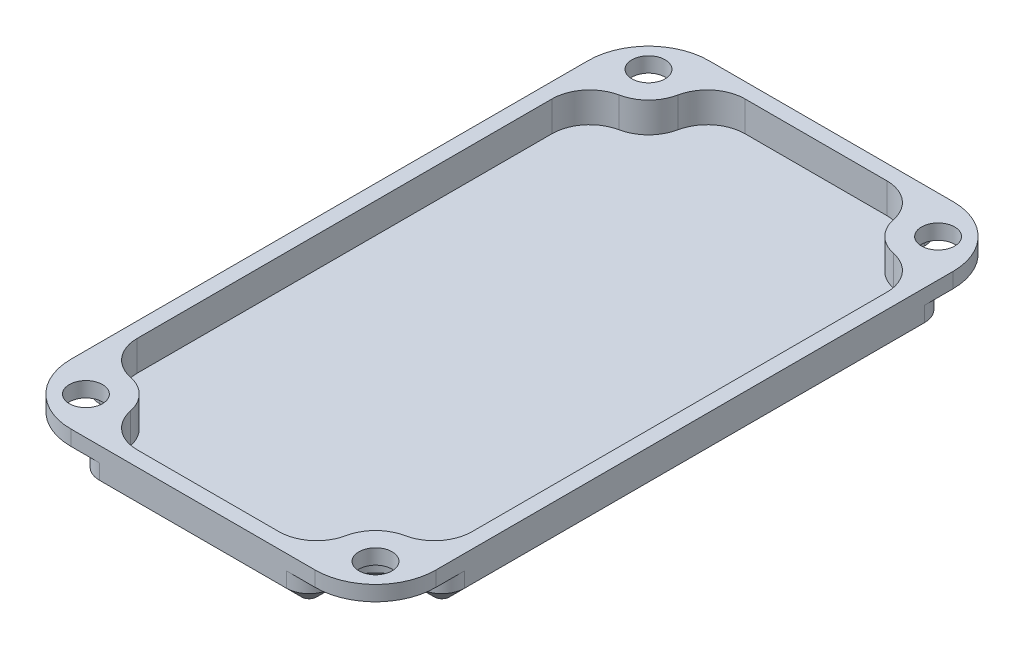
from build123d import *

# Parameters (mm, degrees)
SKETCH_1_W               = 24.2
SKETCH_1_H               = 42.3
EXTRUDE_1_DEPTH          = 3
FILLET_1_R               = 4
CUT_EXTRUDE_1_DEPTH      = 2
EXTRUDE_START            = 2
EXTRUDE_2_DEPTH          = 2
FILLET_2_R               = 2.5
CUT_EXTRUDE_2_DEPTH      = 25.550611138
CUT_EXTRUDE_2_DEPTH_BACK = 25.550611138
SKETCH_4_R               = 1.1
CUT_EXTRUDE_3_DEPTH      = 2
FILLET_3_R               = 1.5
CHAMFER_1_SIZE           = 1


with BuildPart() as part:
    # 草图1 → 凸台-拉伸1 (new body)
    with BuildSketch(Plane(origin=(0, 0, 0), x_dir=(1, 0, 0), z_dir=(0, 1, 0))):
        Rectangle(SKETCH_1_W, SKETCH_1_H)
    extrude(amount=EXTRUDE_1_DEPTH)

    # 圆角1
    fillet_1_edges = [part.edges().sort_by_distance(p)[0] for p in [
        (12.1, 1.5, 21.15),
        (-12.1, 1.5, 21.15),
        (-12.1, 1.5, -21.15),
        (12.1, 1.5, -21.15),
    ]]
    fillet(fillet_1_edges, radius=FILLET_1_R)

    # 草图2 → 切除-拉伸1 (cut)
    with BuildSketch(Plane(origin=(0, 3, 0), x_dir=(1, 0, 0), z_dir=(0, 1, 0))):
        with BuildLine():
            Line((8.1, 20.15), (-8.1, 20.15))
            ThreePointArc((-8.1, 20.15), (-10.221320344, 19.271320344), (-11.1, 17.15))
            Line((-11.1, 17.15), (-11.1, -17.15))
            ThreePointArc((-11.1, -17.15), (-10.221320344, -19.271320344), (-8.1, -20.15))
            Line((-8.1, -20.15), (8.1, -20.15))
            ThreePointArc((8.1, -20.15), (10.221320344, -19.271320344), (11.1, -17.15))
            Line((11.1, -17.15), (11.1, 17.15))
            ThreePointArc((11.1, 17.15), (10.221320344, 19.271320344), (8.1, 20.15))
        make_face()
    extrude(amount=-CUT_EXTRUDE_1_DEPTH, mode=Mode.SUBTRACT)

    # 草图3 → 凸台-拉伸2 (add)
    with BuildSketch(Plane(origin=(0, 1, 0), x_dir=(1, 0, 0), z_dir=(0, 1, 0)).offset(EXTRUDE_START)):
        with BuildLine():
            Line((-9.6, 16.15), (-11.1, 16.15))
            Line((-11.1, 16.15), (-11.1, 17.15))
            ThreePointArc((-11.1, 17.15), (-10.221320344, 19.271320344), (-8.1, 20.15))
            Line((-8.1, 20.15), (-7.1, 20.15))
            Line((-7.1, 20.15), (-7.1, 18.65))
            ThreePointArc((-7.1, 18.65), (-7.832233047, 16.882233047), (-9.6, 16.15))
        make_face()
        with BuildLine():
            Line((7.1, 18.65), (7.1, 20.15))
            Line((7.1, 20.15), (8.1, 20.15))
            ThreePointArc((8.1, 20.15), (10.221320344, 19.271320344), (11.1, 17.15))
            Line((11.1, 17.15), (11.1, 16.15))
            Line((11.1, 16.15), (9.6, 16.15))
            ThreePointArc((9.6, 16.15), (7.832233047, 16.882233047), (7.1, 18.65))
        make_face()
        with BuildLine():
            Line((-8.1, -20.15), (-7.1, -20.15))
            Line((-7.1, -20.15), (-7.1, -18.65))
            ThreePointArc((-7.1, -18.65), (-7.832233047, -16.882233047), (-9.6, -16.15))
            Line((-9.6, -16.15), (-11.1, -16.15))
            Line((-11.1, -16.15), (-11.1, -17.15))
            ThreePointArc((-11.1, -17.15), (-10.221320344, -19.271320344), (-8.1, -20.15))
        make_face()
        with BuildLine():
            Line((11.1, -17.15), (11.1, -16.15))
            Line((11.1, -16.15), (9.6, -16.15))
            ThreePointArc((9.6, -16.15), (7.832233047, -16.882233047), (7.1, -18.65))
            Line((7.1, -18.65), (7.1, -20.15))
            Line((7.1, -20.15), (8.1, -20.15))
            ThreePointArc((8.1, -20.15), (10.221320344, -19.271320344), (11.1, -17.15))
        make_face()
    extrude(amount=-EXTRUDE_2_DEPTH)

    # 圆角2
    fillet_2_edges = [part.edges().sort_by_distance(p)[0] for p in [
        (7.1, 2, 20.15),
        (11.1, 2, 16.15),
        (11.1, 2, -16.15),
        (7.1, 2, -20.15),
        (-7.1, 2, -20.15),
        (-11.1, 2, 16.15),
        (-7.1, 2, 20.15),
        (-11.1, 2, -16.15),
    ]]
    fillet(fillet_2_edges, radius=FILLET_2_R)

    # 草图4 → 切除-拉伸2 (cut, two sides: drawn at the far end of the back side and taken through both)
    with BuildSketch(Plane.XZ.offset(-CUT_EXTRUDE_2_DEPTH_BACK)):
        with Locations(Location((-9.6, 18.65, 0), (0, 0, 270))):
            Circle(SKETCH_4_R)
        with Locations(Location((9.6, 18.65, 0), (0, 0, 270))):
            Circle(SKETCH_4_R)
        with Locations(Location((9.6, -18.65, 0), (0, 0, 270))):
            Circle(SKETCH_4_R)
        with Locations(Location((-9.6, -18.65, 0), (0, 0, 270))):
            Circle(SKETCH_4_R)
    extrude(amount=CUT_EXTRUDE_2_DEPTH + CUT_EXTRUDE_2_DEPTH_BACK, mode=Mode.SUBTRACT)

    # 草图5 → 切除-拉伸3 (cut)
    with BuildSketch(Plane.XZ):
        with BuildLine():
            Line((-9.6, 16.75), (-12.1, 16.75))
            Line((-12.1, 16.75), (-12.1, 21.15))
            Line((-12.1, 21.15), (-7.7, 21.15))
            Line((-7.7, 21.15), (-7.7, 18.65))
            ThreePointArc((-7.7, 18.65), (-8.256497116, 17.306497116), (-9.6, 16.75))
        make_face()
        with BuildLine():
            Line((9.6, 16.75), (12.1, 16.75))
            Line((12.1, 16.75), (12.1, 21.15))
            Line((12.1, 21.15), (7.7, 21.15))
            Line((7.7, 21.15), (7.7, 18.65))
            ThreePointArc((7.7, 18.65), (8.256497116, 17.306497116), (9.6, 16.75))
        make_face()
        with BuildLine():
            Line((9.6, -16.75), (12.1, -16.75))
            Line((12.1, -16.75), (12.1, -21.15))
            Line((12.1, -21.15), (7.7, -21.15))
            Line((7.7, -21.15), (7.7, -18.65))
            ThreePointArc((7.7, -18.65), (8.256497116, -17.306497116), (9.6, -16.75))
        make_face()
        with BuildLine():
            Line((-9.6, -16.75), (-12.1, -16.75))
            Line((-12.1, -16.75), (-12.1, -21.15))
            Line((-12.1, -21.15), (-7.7, -21.15))
            Line((-7.7, -21.15), (-7.7, -18.65))
            ThreePointArc((-7.7, -18.65), (-8.256497116, -17.306497116), (-9.6, -16.75))
        make_face()
    extrude(amount=-CUT_EXTRUDE_3_DEPTH, mode=Mode.SUBTRACT)

    # 圆角3
    fillet_3_edges = [part.edges().sort_by_distance(p)[0] for p in [
        (-7.7, 1, -21.15),
        (-12.1, 1, -16.75),
        (12.1, 1, -16.75),
        (7.7, 1, -21.15),
        (7.7, 1, 21.15),
        (12.1, 1, 16.75),
        (-12.1, 1, 16.75),
        (-7.7, 1, 21.15),
    ]]
    fillet(fillet_3_edges, radius=FILLET_3_R)

    # 倒角1
    chamfer_1_edges = [part.edges().sort_by_distance(p)[0] for p in [
        (-8.256497116, 0, -17.306497116),
        (-10.1, 0, -16.75),
        (8.256497116, 0, -17.306497116),
        (7.7, 0, -19.15),
        (8.256497116, 0, 17.306497116),
        (10.1, 0, 16.75),
        (-8.256497116, 0, 17.306497116),
        (-7.7, 0, 19.15),
        (-12.1, 0, 0),
        (-7.7, 0, -19.15),
        (0, 0, -21.15),
        (10.1, 0, -16.75),
        (12.1, 0, 0),
        (7.7, 0, 19.15),
        (0, 0, 21.15),
        (-10.1, 0, 16.75),
        (-11.660660172, 0, 16.310660172),
        (-7.260660172, 0, -20.710660172),
        (7.260660172, 0, -20.710660172),
        (11.660660172, 0, -16.310660172),
        (11.660660172, 0, 16.310660172),
        (7.260660172, 0, 20.710660172),
        (-7.260660172, 0, 20.710660172),
        (-11.660660172, 0, -16.310660172),
    ]]
    chamfer(chamfer_1_edges, length=CHAMFER_1_SIZE)


solid = part.part
